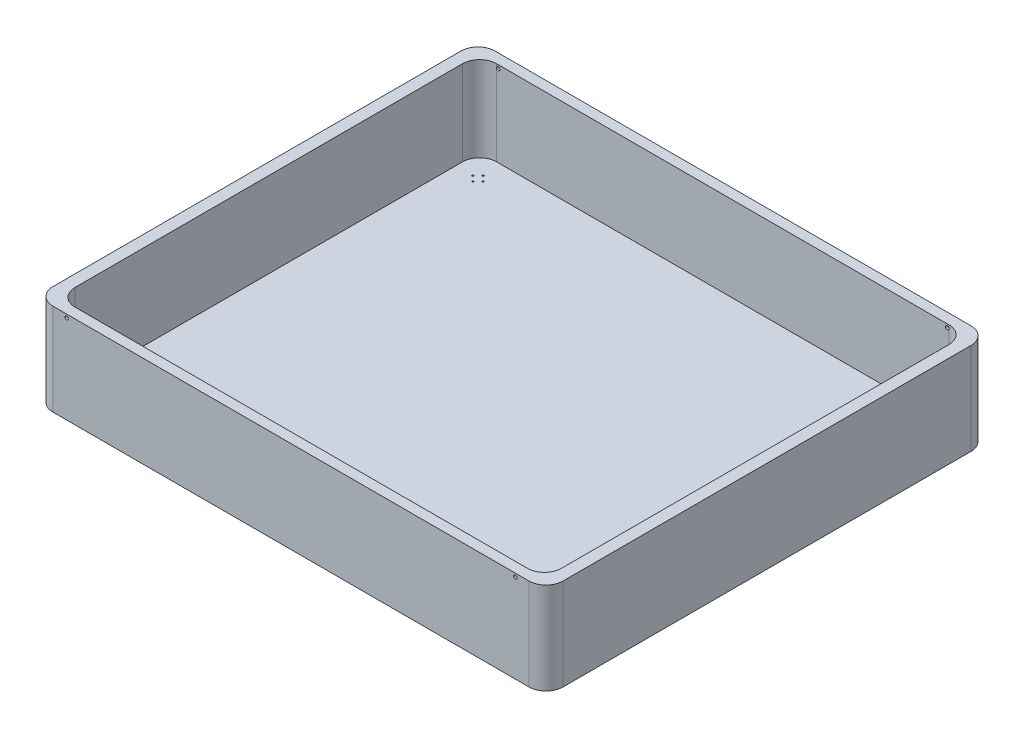
from build123d import *

# Parameters (mm, degrees)
EXTRUDE_1_DEPTH     = 20
EXTRUDE_2_DEPTH     = 250
SKETCH_3_R          = 2.5
CUT_EXTRUDE_1_DEPTH = 250
SKETCH_4_R          = 5
CUT_EXTRUDE_2_DEPTH = 1500


with BuildPart() as part:
    # Эскиз1 → Бобышка-Вытянуть1 (new body)
    with BuildSketch(Plane(origin=(0, 0, 0), x_dir=(1, 0, 0), z_dir=(0, 1, 0))):
        with BuildLine():
            Line((-700, -650), (700, -650))
            ThreePointArc((700, -650), (735.355339059, -635.355339059), (750, -600))
            Line((750, -600), (750, 600))
            ThreePointArc((750, 600), (735.355339059, 635.355339059), (700, 650))
            Line((700, 650), (-700, 650))
            ThreePointArc((-700, 650), (-735.355339059, 635.355339059), (-750, 600))
            Line((-750, 600), (-750, -600))
            ThreePointArc((-750, -600), (-735.355339059, -635.355339059), (-700, -650))
        make_face()
    extrude(amount=EXTRUDE_1_DEPTH)

    # Эскиз2 → Бобышка-Вытянуть2 (add)
    with BuildSketch(Plane(origin=(0, 20, 0), x_dir=(1, 0, 0), z_dir=(0, 1, 0))):
        with BuildLine():
            Line((700, -650), (-700, -650))
            ThreePointArc((-700, -650), (-735.355339059, -635.355339059), (-750, -600))
            Line((-750, -600), (-750, 600))
            ThreePointArc((-750, 600), (-735.355339059, 635.355339059), (-700, 650))
            Line((-700, 650), (700, 650))
            ThreePointArc((700, 650), (735.355339059, 635.355339059), (750, 600))
            Line((750, 600), (750, -600))
            ThreePointArc((750, -600), (735.355339059, -635.355339059), (700, -650))
        make_face()
        with BuildLine():
            Line((665.384615385, -620), (-665.384615385, -620))
            ThreePointArc((-665.384615385, -620), (-700.739954444, -605.355339059), (-715.384615385, -570))
            Line((-715.384615385, -570), (-715.384615385, 570))
            ThreePointArc((-715.384615385, 570), (-700.739954444, 605.355339059), (-665.384615385, 620))
            Line((-665.384615385, 620), (665.384615385, 620))
            ThreePointArc((665.384615385, 620), (700.739954444, 605.355339059), (715.384615385, 570))
            Line((715.384615385, 570), (715.384615385, -570))
            ThreePointArc((715.384615385, -570), (700.739954444, -605.355339059), (665.384615385, -620))
        make_face(mode=Mode.SUBTRACT)
    extrude(amount=EXTRUDE_2_DEPTH)

    # Эскиз3 → Вырез-Вытянуть1 (cut)
    with BuildSketch(Plane.XZ):
        with Locations(Location((-650, -565, 0), (0, 0, 270))):
            Circle(SKETCH_3_R)
        with Locations(Location((-650, 565, 0), (0, 0, 270))):
            Circle(SKETCH_3_R)
        with Locations(Location((-665, 550, 0), (0, 0, 270))):
            Circle(SKETCH_3_R)
        with Locations(Location((-635, 550, 0), (0, 0, 270))):
            Circle(SKETCH_3_R)
        with Locations(Location((-650, 535, 0), (0, 0, 270))):
            Circle(SKETCH_3_R)
        with Locations(Location((665, 550, 0), (0, 0, 270))):
            Circle(SKETCH_3_R)
        with Locations(Location((650, 565, 0), (0, 0, 270))):
            Circle(SKETCH_3_R)
        with Locations(Location((635, 550, 0), (0, 0, 270))):
            Circle(SKETCH_3_R)
        with Locations(Location((650, 535, 0), (0, 0, 270))):
            Circle(SKETCH_3_R)
        with Locations(Location((650, -535, 0), (0, 0, 270))):
            Circle(SKETCH_3_R)
        with Locations(Location((635, -550, 0), (0, 0, 270))):
            Circle(SKETCH_3_R)
        with Locations(Location((665, -550, 0), (0, 0, 270))):
            Circle(SKETCH_3_R)
        with Locations(Location((650, -565, 0), (0, 0, 270))):
            Circle(SKETCH_3_R)
        with Locations(Location((-650, -535, 0), (0, 0, 270))):
            Circle(SKETCH_3_R)
        with Locations(Location((-665, -550, 0), (0, 0, 270))):
            Circle(SKETCH_3_R)
        with Locations(Location((-635, -550, 0), (0, 0, 270))):
            Circle(SKETCH_3_R)
    extrude(amount=-CUT_EXTRUDE_1_DEPTH, mode=Mode.SUBTRACT)

    # Эскиз4 → Вырез-Вытянуть2 (cut)
    with BuildSketch(Plane(origin=(0, 0, -650), x_dir=(-1, 0, 0), z_dir=(0, 0, -1))):
        with Locations((660, 260)):
            Circle(SKETCH_4_R)
    cut_extrude_2 = extrude(amount=-CUT_EXTRUDE_2_DEPTH, mode=Mode.SUBTRACT)

    # Зеркальное отражение1: Вырез-Вытянуть2 across plane
    add(cut_extrude_2.mirror(Plane.ZY), mode=Mode.SUBTRACT)


solid = part.part
